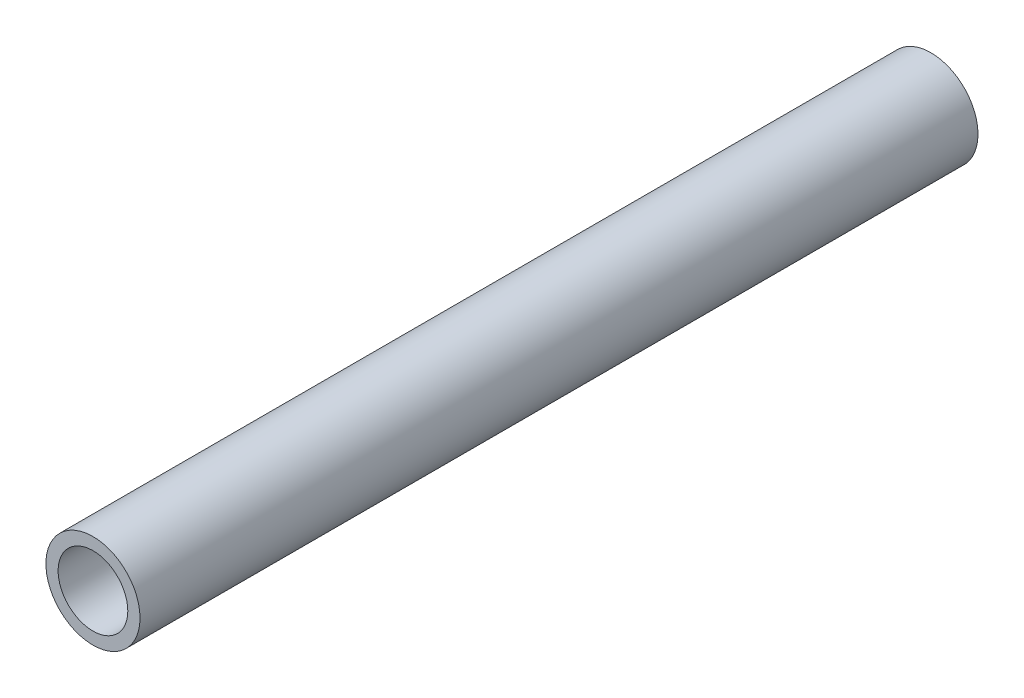
from build123d import *

# Parameters (mm, degrees)
SKETCH1_R           = 10.668
SKETCH1_R_2         = 7.8994
EXTRUDE_THIN1_DEPTH = 95


with BuildPart() as part:
    # Sketch1 → Extrude-Thin1 (new, symmetric)
    with BuildSketch(Plane.XY):
        Circle(SKETCH1_R)
        Circle(SKETCH1_R_2, mode=Mode.SUBTRACT)
    extrude(amount=EXTRUDE_THIN1_DEPTH, both=True)


solid = part.part
